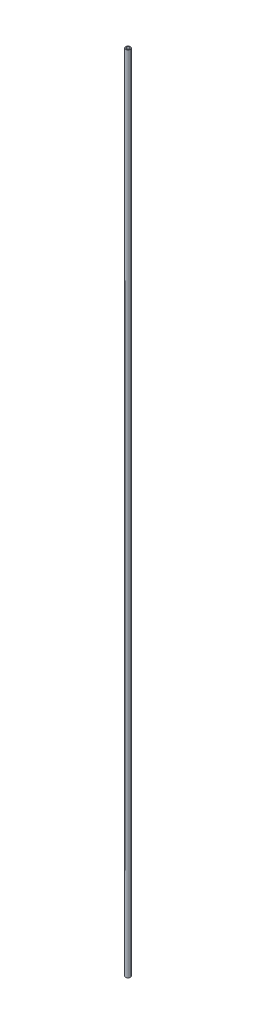
from build123d import *

# Parameters (mm, degrees)
SKETCH_1_R          = 0.6
EXTRUDE_1_DEPTH     = 200
SKETCH_2_R          = 0.4
CUT_EXTRUDE_1_DEPTH = 201.001799992


with BuildPart() as part:
    # 草图1 → 凸台-拉伸1 (new body)
    with BuildSketch(Plane(origin=(0, 0, 0), x_dir=(1, 0, 0), z_dir=(0, 1, 0))):
        with Locations(Location((0, 0, 0), (0, 0, 270))):
            Circle(SKETCH_1_R)
    extrude(amount=EXTRUDE_1_DEPTH)

    # 草图2 → 切除-拉伸1 (cut, through all)
    with BuildSketch(Plane.XZ):
        with Locations(Location((0, 0, 0), (0, 0, 270))):
            Circle(SKETCH_2_R)
    extrude(amount=-CUT_EXTRUDE_1_DEPTH, mode=Mode.SUBTRACT)


solid = part.part
